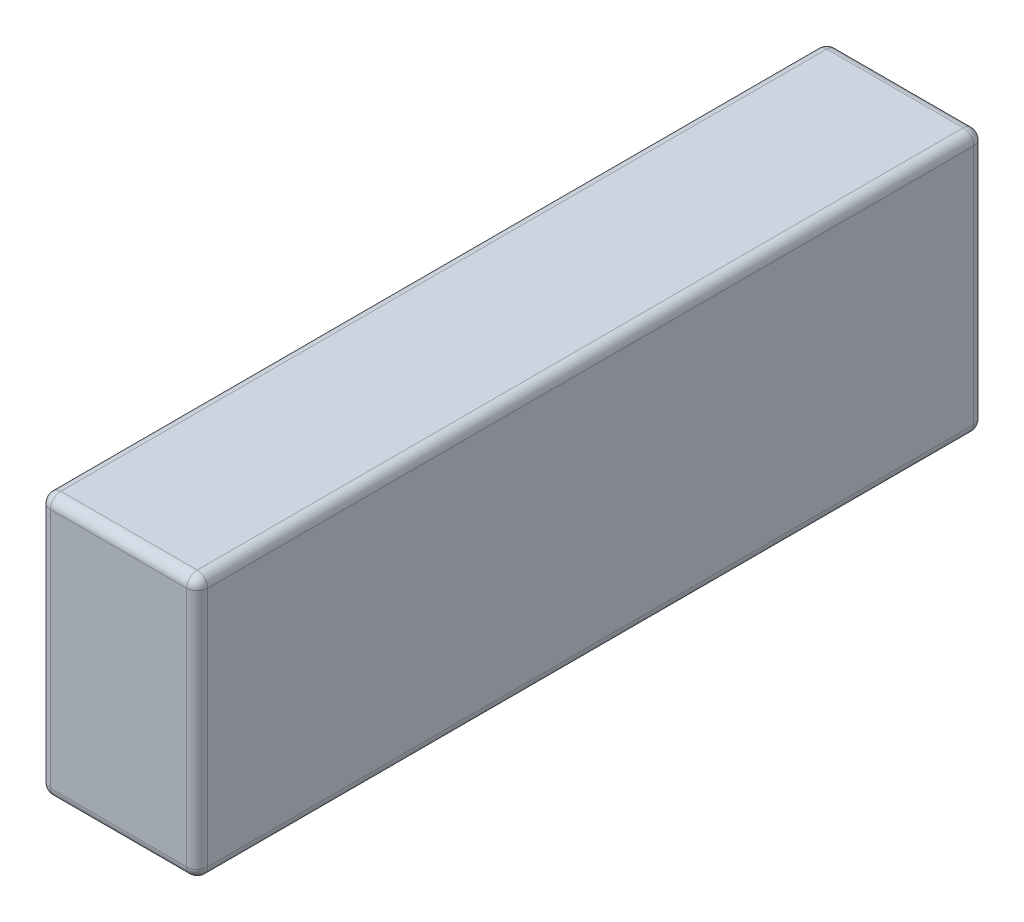
from build123d import *

# Parameters (mm, degrees)
SKETCH2_W           = 15
SKETCH2_H           = 5
BOSS_EXTRUDE1_DEPTH = 3
FILLET1_R           = 0.2


with BuildPart() as part:
    # Sketch2 → Boss-Extrude1 (new body)
    with BuildSketch(Plane(origin=(0, 0, 0), x_dir=(0, 0, -1), z_dir=(1, 0, 0))):
        Rectangle(SKETCH2_W, SKETCH2_H)
    extrude(amount=BOSS_EXTRUDE1_DEPTH)

    # Fillet1
    fillet1_edges = [part.edges().sort_by_distance(p)[0] for p in [
        (3, 0, 7.5),
        (3, -2.5, 0),
        (3, 0, -7.5),
        (0, -2.5, 0),
        (0, 0, 7.5),
        (0, 2.5, 0),
        (0, 0, -7.5),
        (1.5, -2.5, -7.5),
        (1.5, -2.5, 7.5),
        (1.5, 2.5, 7.5),
        (1.5, 2.5, -7.5),
        (3, 2.5, 0),
    ]]
    fillet(fillet1_edges, radius=FILLET1_R)


solid = part.part
